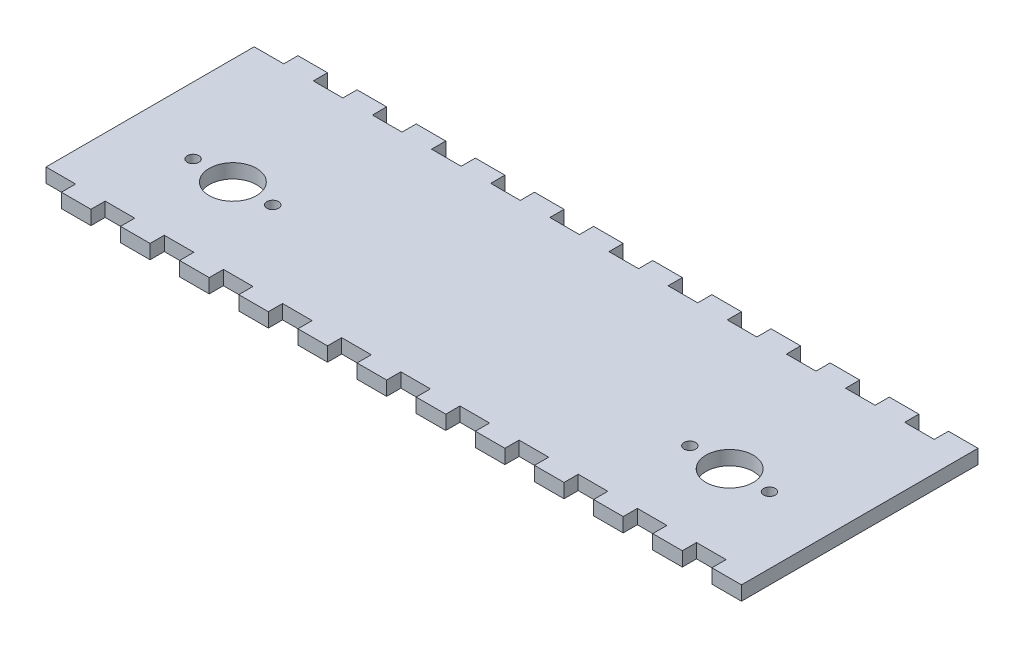
from build123d import *

# Parameters (mm, degrees)
SKETCH1_W           = 152.4
SKETCH1_H           = 50.8
BOSS_EXTRUDE1_DEPTH = 3.048
SKETCH2_W           = 6.35
SKETCH2_H           = 3.048
CUT_EXTRUDE1_DEPTH  = 81.379663498
SKETCH4_R           = 1.25
SKETCH4_R_2         = 5.08
CUT_EXTRUDE2_DEPTH  = 81.379663498


with BuildPart() as part:
    # Sketch1 → Boss-Extrude1 (new body)
    with BuildSketch(Plane(origin=(0, 0, 0), x_dir=(1, 0, 0), z_dir=(0, 1, 0))):
        Rectangle(SKETCH1_W, SKETCH1_H)
    extrude(amount=BOSS_EXTRUDE1_DEPTH)

    # Sketch2 → Cut-Extrude1 (cut, through all)
    with BuildSketch(Plane(origin=(0, 3.048, 0), x_dir=(1, 0, 0), z_dir=(0, 1, 0))):
        with Locations((-73.025, 23.876)):
            Rectangle(SKETCH2_W, SKETCH2_H)
        with Locations((-60.325, 23.876)):
            Rectangle(SKETCH2_W, SKETCH2_H)
        with Locations((-47.625, 23.876)):
            Rectangle(SKETCH2_W, SKETCH2_H)
        with Locations((-34.925, 23.876)):
            Rectangle(SKETCH2_W, SKETCH2_H)
        with Locations((-22.225, 23.876)):
            Rectangle(SKETCH2_W, SKETCH2_H)
        with Locations((-9.525, 23.876)):
            Rectangle(SKETCH2_W, SKETCH2_H)
        with Locations((15.875, 23.876)):
            Rectangle(SKETCH2_W, SKETCH2_H)
        with Locations((3.175, 23.876)):
            Rectangle(SKETCH2_W, SKETCH2_H)
        with Locations((28.575, 23.876)):
            Rectangle(SKETCH2_W, SKETCH2_H)
        with Locations((41.275, 23.876)):
            Rectangle(SKETCH2_W, SKETCH2_H)
        with Locations((53.975, 23.876)):
            Rectangle(SKETCH2_W, SKETCH2_H)
        with Locations((66.675, 23.876)):
            Rectangle(SKETCH2_W, SKETCH2_H)
        with Locations((-73.025, -23.876)):
            Rectangle(SKETCH2_W, SKETCH2_H)
        with Locations((-60.325, -23.876)):
            Rectangle(SKETCH2_W, SKETCH2_H)
        with Locations((-47.625, -23.876)):
            Rectangle(SKETCH2_W, SKETCH2_H)
        with Locations((-34.925, -23.876)):
            Rectangle(SKETCH2_W, SKETCH2_H)
        with Locations((-22.225, -23.876)):
            Rectangle(SKETCH2_W, SKETCH2_H)
        with Locations((-9.525, -23.876)):
            Rectangle(SKETCH2_W, SKETCH2_H)
        with Locations((3.175, -23.876)):
            Rectangle(SKETCH2_W, SKETCH2_H)
        with Locations((15.875, -23.876)):
            Rectangle(SKETCH2_W, SKETCH2_H)
        with Locations((28.575, -23.876)):
            Rectangle(SKETCH2_W, SKETCH2_H)
        with Locations((41.275, -23.876)):
            Rectangle(SKETCH2_W, SKETCH2_H)
        with Locations((53.975, -23.876)):
            Rectangle(SKETCH2_W, SKETCH2_H)
        with Locations((66.675, -23.876)):
            Rectangle(SKETCH2_W, SKETCH2_H)
    extrude(amount=-CUT_EXTRUDE1_DEPTH, mode=Mode.SUBTRACT)

    # Sketch4 → Cut-Extrude2 (cut, through all)
    with BuildSketch(Plane(origin=(0, 3.048, 0), x_dir=(1, 0, 0), z_dir=(0, 1, 0))):
        with Locations(Location((-61.89, -5.08, 0), (0, 0, 270))):
            Circle(SKETCH4_R)
        with Locations(Location((-44.79, -5.08, 0), (0, 0, 270))):
            Circle(SKETCH4_R)
        with Locations(Location((-53.34, -5.08, 0), (0, 0, 270))):
            Circle(SKETCH4_R_2)
        with Locations(Location((44.79, -5.08, 0), (0, 0, 270))):
            Circle(SKETCH4_R)
        with Locations(Location((53.34, -5.08, 0), (0, 0, 270))):
            Circle(SKETCH4_R_2)
        with Locations(Location((61.89, -5.08, 0), (0, 0, 270))):
            Circle(SKETCH4_R)
    extrude(amount=-CUT_EXTRUDE2_DEPTH, mode=Mode.SUBTRACT)


solid = part.part
